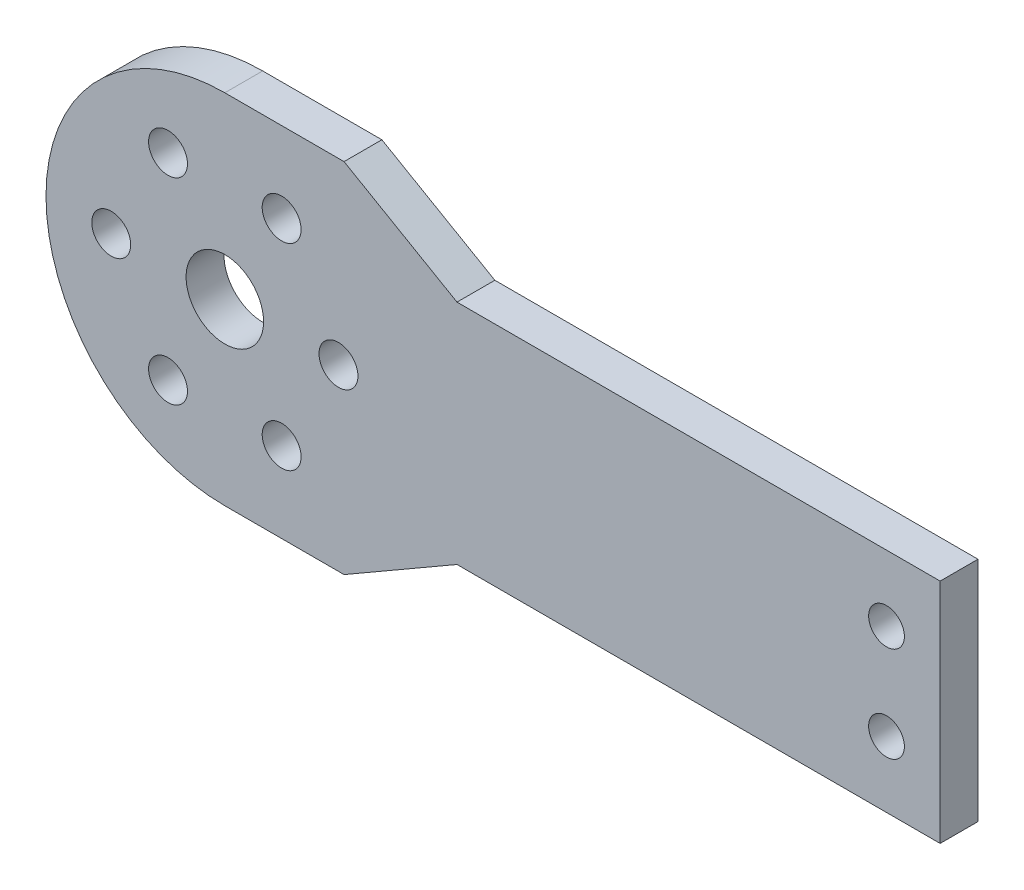
from build123d import *

# Parameters (mm, degrees)
CROQUIS1_R                      = 1.5
CROQUIS1_R_2                    = 3.25
SALIENTE_EXTRUIR1_DEPTH         = 3.175
TALADRO_DE_MARGEN_PARA_41_D     = 3.2639
TALADRO_DE_MARGEN_PARA_41_DEPTH = 10
TALADRO_DE_MARGEN_PARA_41_TIP   = 0.980574487


with BuildPart() as part:
    # Croquis1 → Saliente-Extruir1 (new body)
    with BuildSketch(Plane.XY.offset(86.203907482)):
        with BuildLine():
            Line((0, -15), (10, -15))
            Line((10, -15), (19.474317917, -9.53))
            Line((19.474317917, -9.53), (60, -9.53))
            Line((60, -9.53), (60, 9.53))
            Line((60, 9.53), (19.474317917, 9.53))
            Line((19.474317917, 9.53), (10, 15))
            Line((10, 15), (0, 15))
            ThreePointArc((0, 15), (-15, 0), (0, -15))
        make_face()
        with Locations((55.5, 4)):
            Circle(CROQUIS1_R, mode=Mode.SUBTRACT)
        Circle(CROQUIS1_R_2, mode=Mode.SUBTRACT)
        with Locations((55.5, -4)):
            Circle(CROQUIS1_R, mode=Mode.SUBTRACT)
    extrude(amount=SALIENTE_EXTRUIR1_DEPTH)

    # Taladro de margen para #41
    with Locations(Plane.XY.offset(89.378907482)):
        with Locations((4.765, 8.253222098), (9.53, 0), (4.765, -8.253222098), (-4.765, -8.253222098), (-9.53, 0), (-4.765, 8.253222098)):
            Hole(TALADRO_DE_MARGEN_PARA_41_D / 2, depth=TALADRO_DE_MARGEN_PARA_41_DEPTH)
            with Locations((0, 0, -(TALADRO_DE_MARGEN_PARA_41_DEPTH + TALADRO_DE_MARGEN_PARA_41_TIP / 2))):  # 118° drill point
                Cone(0, TALADRO_DE_MARGEN_PARA_41_D / 2, TALADRO_DE_MARGEN_PARA_41_TIP, mode=Mode.SUBTRACT)


solid = part.part
